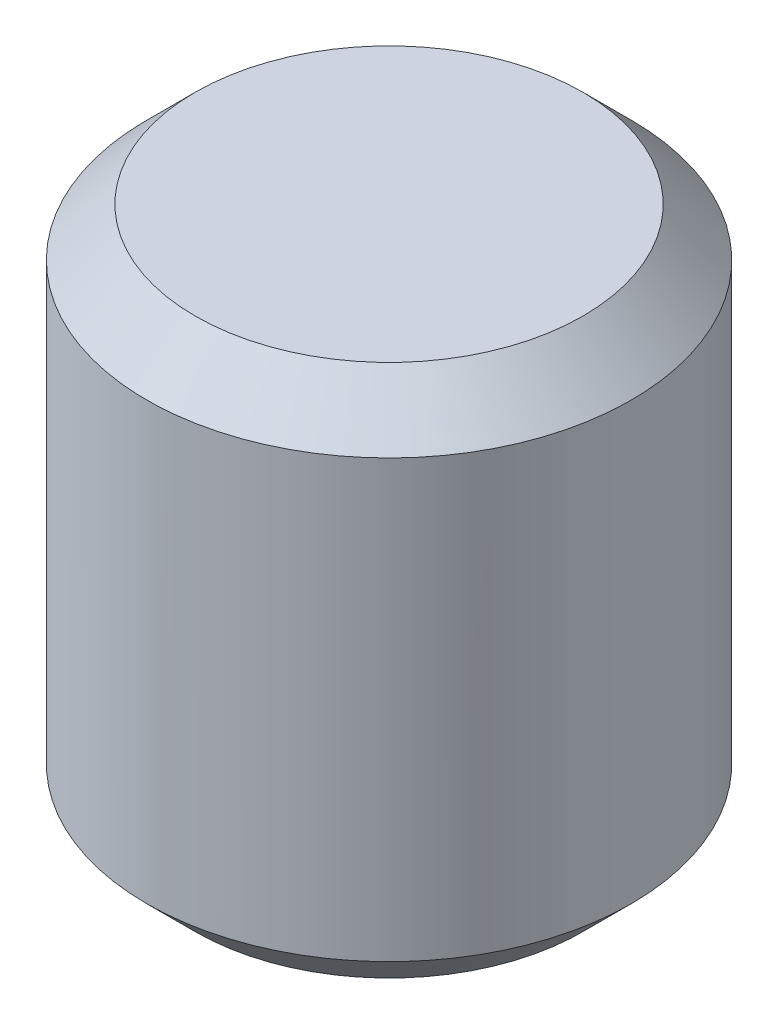
from build123d import *

# Parameters (mm, degrees)
SKETCH1_R           = 1.75
BOSS_EXTRUDE1_DEPTH = 3.85
CHAMFER1_SIZE       = 0.35


with BuildPart() as part:
    # Sketch1 → Boss-Extrude1 (new body)
    with BuildSketch(Plane(origin=(0, 0, 0), x_dir=(1, 0, 0), z_dir=(0, 1, 0))):
        with Locations(Location((0, 0, 0), (0, 0, 90))):
            Circle(SKETCH1_R)
    extrude(amount=BOSS_EXTRUDE1_DEPTH)

    # Chamfer1
    chamfer1_edges = [part.edges().sort_by_distance(p)[0] for p in [
        (0, 0, 1.75),
        (0, 3.85, 1.75),
    ]]
    chamfer(chamfer1_edges, length=CHAMFER1_SIZE)


solid = part.part
